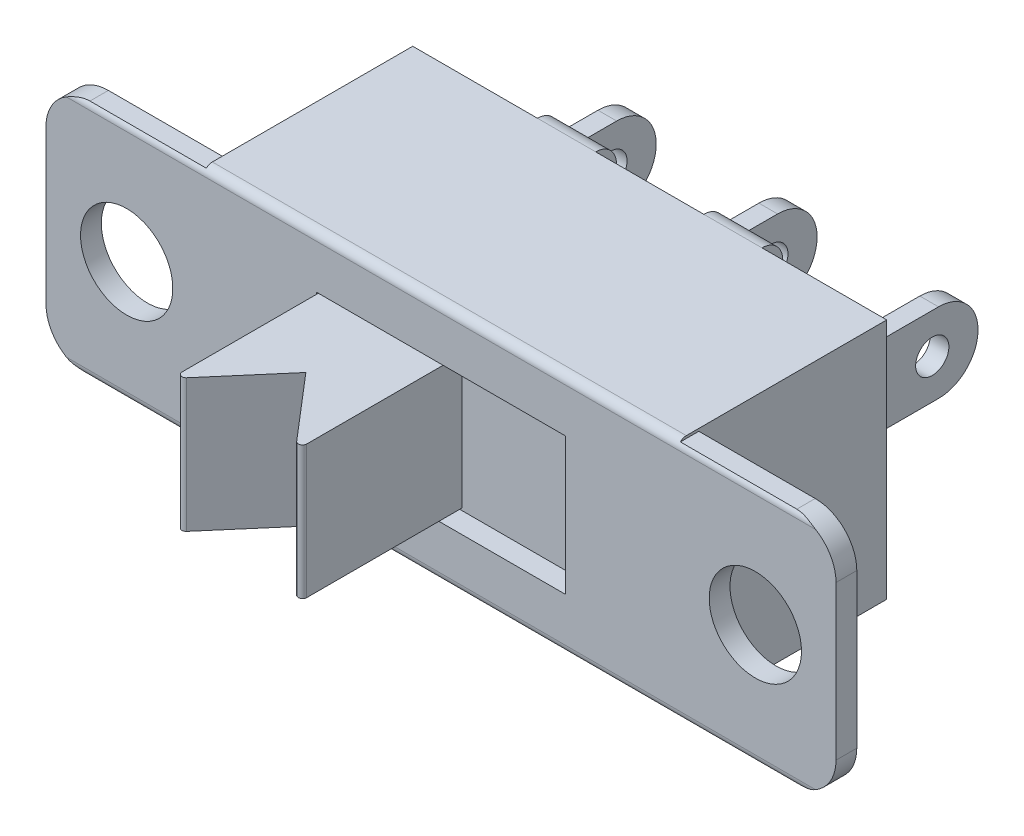
from build123d import *

# Parameters (mm, degrees)
ESQUISSE1_R             = 1.11
BASE_EXTRUSION_DEPTH    = 0.5
ESQUISSE2_W             = 11.4
ESQUISSE2_H             = 5.82
BOSS_EXTRU_1_DEPTH      = 5.02
ESQUISSE3_W             = 6
ESQUISSE3_H             = 3.3
ENL_V_MAT_EXTRU_1_DEPTH = 0.5
ESQUISSE4_W             = 3
ESQUISSE4_H             = 3.2
BOSS_EXTRU_2_DEPTH      = 4
ENL_V_MAT_EXTRU_2_DEPTH = 12.446418654
CONG_1_R                = 0.1
ESQUISSE6_W             = 0.45
ESQUISSE6_H             = 1.91
BOSS_EXTRU_3_DEPTH      = 3.8
CONG_2_R                = 0.95
ESQUISSE7_R             = 0.4
ENL_V_MAT_EXTRU_3_DEPTH = 17.202299991
ESQUISSE8_W             = 1.4
ESQUISSE8_H             = 1.4
BOSS_EXTRU_4_DEPTH      = 0.5
CONG_3_R                = 0.5
CONG_4_R                = 0.2


with BuildPart() as part:
    # Esquisse1 → Base-Extrusion (new body)
    with BuildSketch(Plane.XY):
        with BuildLine():
            Line((-8.5, 2.85), (8.5, 2.85))
            ThreePointArc((8.5, 2.85), (9.207106781, 2.557106781), (9.5, 1.85))
            Line((9.5, 1.85), (9.5, -1.85))
            ThreePointArc((9.5, -1.85), (9.207106781, -2.557106781), (8.5, -2.85))
            Line((8.5, -2.85), (-8.5, -2.85))
            ThreePointArc((-8.5, -2.85), (-9.207106781, -2.557106781), (-9.5, -1.85))
            Line((-9.5, -1.85), (-9.5, 1.85))
            ThreePointArc((-9.5, 1.85), (-9.207106781, 2.557106781), (-8.5, 2.85))
        make_face()
        with Locations((7.56, 0)):
            Circle(ESQUISSE1_R, mode=Mode.SUBTRACT)
        with Locations(Location((-7.56, 0, 0), (0, 0, 180))):
            Circle(ESQUISSE1_R, mode=Mode.SUBTRACT)
    extrude(amount=BASE_EXTRUSION_DEPTH)

    # Esquisse2 → Boss.-Extru.1 (add)
    with BuildSketch(Plane.XY.offset(0.5)):
        Rectangle(ESQUISSE2_W, ESQUISSE2_H)
    extrude(amount=-BOSS_EXTRU_1_DEPTH)

    # Esquisse3 → Enlèv. mat.-Extru.1 (cut)
    with BuildSketch(Plane.XY.offset(0.5)):
        Rectangle(ESQUISSE3_W, ESQUISSE3_H)
    extrude(amount=-ENL_V_MAT_EXTRU_1_DEPTH, mode=Mode.SUBTRACT)

    # Esquisse4 → Boss.-Extru.2 (add)
    with BuildSketch(Plane.XY):
        with Locations((-1.5, 0)):
            Rectangle(ESQUISSE4_W, ESQUISSE4_H)
    extrude(amount=BOSS_EXTRU_2_DEPTH)

    # Esquisse5 → Enlèv. mat.-Extru.2 (cut, through all)
    with BuildSketch(Plane.XZ.offset(1.6)):
        Polygon((0, 4), (-1.5, 2.25), (-3, 4), (-3, 5.046492564), (0, 5.046492564), align=None)
    extrude(amount=-ENL_V_MAT_EXTRU_2_DEPTH, mode=Mode.SUBTRACT)

    # Congé1
    cong_1_edges = [part.edges().sort_by_distance(p)[0] for p in [
        (-3, 0, 4),
        (0, 0, 4),
    ]]
    fillet(cong_1_edges, radius=CONG_1_R)

    # Esquisse6 → Boss.-Extru.3 (add)
    with BuildSketch(Plane(origin=(0, 0, -4.52), x_dir=(-1, 0, 0), z_dir=(0, 0, -1))):
        Rectangle(ESQUISSE6_W, ESQUISSE6_H)
        with Locations((3.87, 0)):
            Rectangle(ESQUISSE6_W, ESQUISSE6_H)
        with Locations((-3.87, 0)):
            Rectangle(ESQUISSE6_W, ESQUISSE6_H)
    extrude(amount=BOSS_EXTRU_3_DEPTH)

    # Congé2
    cong_2_edges = [part.edges().sort_by_distance(p)[0] for p in [
        (3.87, 0.955, -8.32),
        (3.87, -0.955, -8.32),
        (0, -0.955, -8.32),
        (0, 0.955, -8.32),
        (-3.87, -0.955, -8.32),
        (-3.87, 0.955, -8.32),
    ]]
    fillet(cong_2_edges, radius=CONG_2_R)

    # Esquisse7 → Enlèv. mat.-Extru.3 (cut, through all)
    with BuildSketch(Plane(origin=(4.095, 0, 0), x_dir=(0, 0, -1), z_dir=(1, 0, 0))):
        with Locations((7.22, 0)):
            Circle(ESQUISSE7_R)
    extrude(amount=-ENL_V_MAT_EXTRU_3_DEPTH, mode=Mode.SUBTRACT)

    # Esquisse8 → Boss.-Extru.4 (add)
    with BuildSketch(Plane(origin=(0, 0, -4.52), x_dir=(-1, 0, 0), z_dir=(0, 0, -1))):
        with Locations((2, -2.21)):
            Rectangle(ESQUISSE8_W, ESQUISSE8_H)
        with Locations((2, 2.21)):
            Rectangle(ESQUISSE8_W, ESQUISSE8_H)
        with Locations((-2, 2.21)):
            Rectangle(ESQUISSE8_W, ESQUISSE8_H)
        with Locations((-2, -2.21)):
            Rectangle(ESQUISSE8_W, ESQUISSE8_H)
    extrude(amount=BOSS_EXTRU_4_DEPTH)

    # Congé3
    cong_3_edges = [part.edges().sort_by_distance(p)[0] for p in [
        (2, -2.91, -5.02),
        (-2, -2.91, -5.02),
        (-2, 2.91, -5.02),
        (2, 2.91, -5.02),
    ]]
    fillet(cong_3_edges, radius=CONG_3_R)

    # Congé4
    cong_4_edges = [part.edges().sort_by_distance(p)[0] for p in [
        (0, -2.91, 0.5),
        (0, 2.91, 0.5),
    ]]
    fillet(cong_4_edges, radius=CONG_4_R)


solid = part.part
